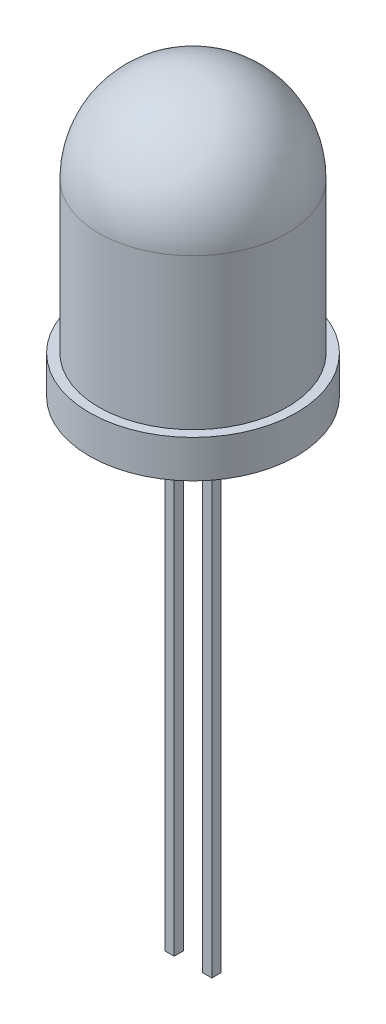
from build123d import *

# Parameters (mm, degrees)
SKETCH1_R           = 5.5
BOSS_EXTRUDE1_DEPTH = 2
SKETCH2_R           = 5
BOSS_EXTRUDE2_DEPTH = 8
REVOLVE1_ANGLE      = 180
SKETCH4_W           = 0.5
SKETCH4_H           = 0.5
BOSS_EXTRUDE3_DEPTH = 26


with BuildPart() as part:
    # Sketch1 → Boss-Extrude1 (new body)
    with BuildSketch(Plane(origin=(0, 0, 0), x_dir=(1, 0, 0), z_dir=(0, 1, 0))):
        with Locations(Location((0, 0, 0), (0, 0, 270))):
            Circle(SKETCH1_R)
    extrude(amount=BOSS_EXTRUDE1_DEPTH)

    # Sketch2 → Boss-Extrude2 (add)
    with BuildSketch(Plane(origin=(0, 2, 0), x_dir=(1, 0, 0), z_dir=(0, 1, 0))):
        with Locations(Location((0, 0, 0), (0, 0, 270))):
            Circle(SKETCH2_R)
    extrude(amount=BOSS_EXTRUDE2_DEPTH)

    # Sketch3 → Revolve1 (revolve)
    with BuildSketch(Plane(origin=(0, 10, 0), x_dir=(1, 0, 0), z_dir=(0, 1, 0))):
        with BuildLine():
            Line((0, 5), (0, -5))
            ThreePointArc((0, -5), (5, 0), (0, 5))
        make_face()
    revolve(axis=Axis((0, 10, -5), (0, 0, 1)), revolution_arc=REVOLVE1_ANGLE)

    # Sketch4 → Boss-Extrude3 (add)
    with BuildSketch(Plane.XZ):
        with Locations((-1, 0)):
            Rectangle(SKETCH4_W, SKETCH4_H)
        with Locations((1, 0)):
            Rectangle(SKETCH4_W, SKETCH4_H)
    extrude(amount=BOSS_EXTRUDE3_DEPTH)


solid = part.part
